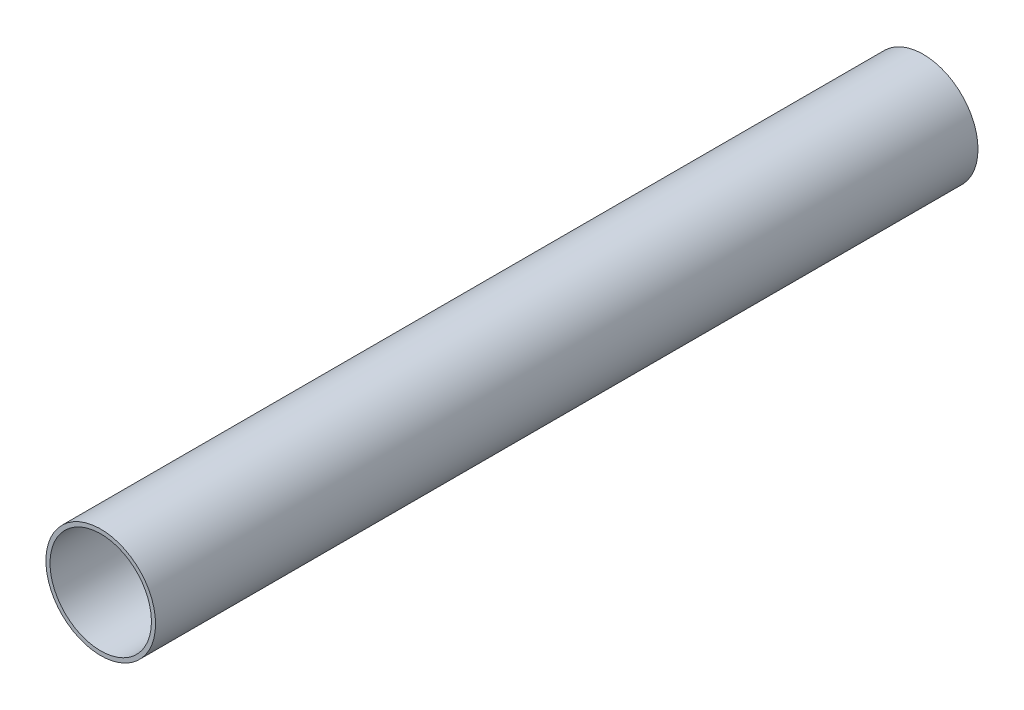
from build123d import *

# Parameters (mm, degrees)
SKETCH1_R           = 20
SKETCH1_R_2         = 18.5
BOSS_EXTRUDE1_DEPTH = 150


with BuildPart() as part:
    # Sketch1 → Boss-Extrude1 (new, symmetric)
    with BuildSketch(Plane.XY):
        Circle(SKETCH1_R)
        Circle(SKETCH1_R_2, mode=Mode.SUBTRACT)
    extrude(amount=BOSS_EXTRUDE1_DEPTH, both=True)


solid = part.part
